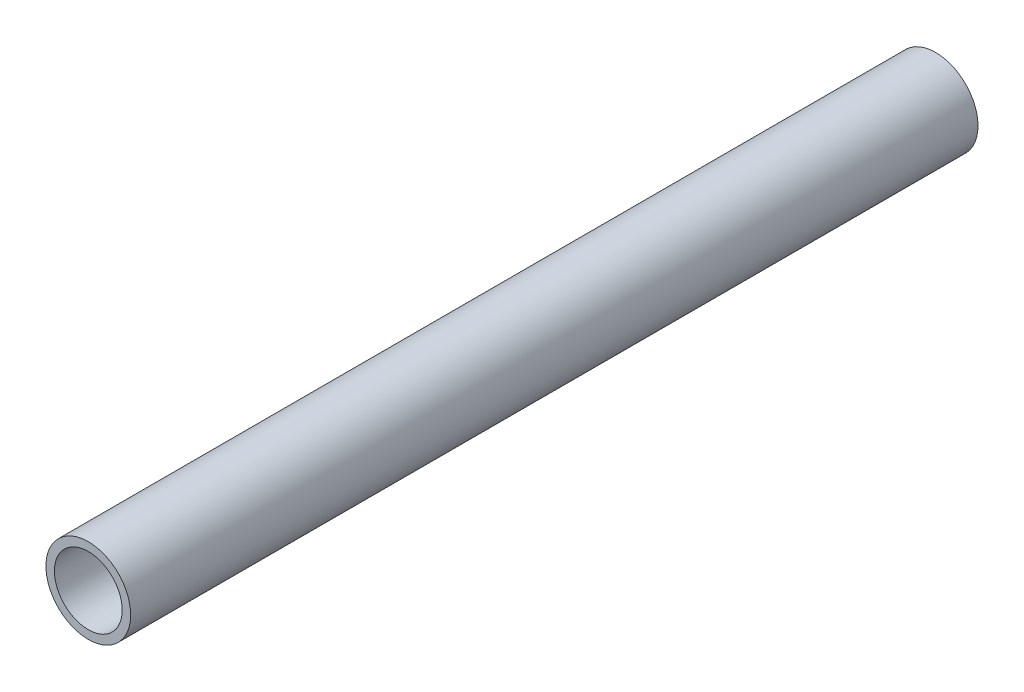
from build123d import *

# Parameters (mm, degrees)
SZKIC1_R                    = 10
SZKIC1_R_2                  = 8
DODANIE_WYCI_GNI_CIE1_DEPTH = 200


with BuildPart() as part:
    # Szkic1 → Dodanie-wyciągnięcie1 (new body)
    with BuildSketch(Plane.XY):
        Circle(SZKIC1_R)
        Circle(SZKIC1_R_2, mode=Mode.SUBTRACT)
    extrude(amount=DODANIE_WYCI_GNI_CIE1_DEPTH)


solid = part.part
